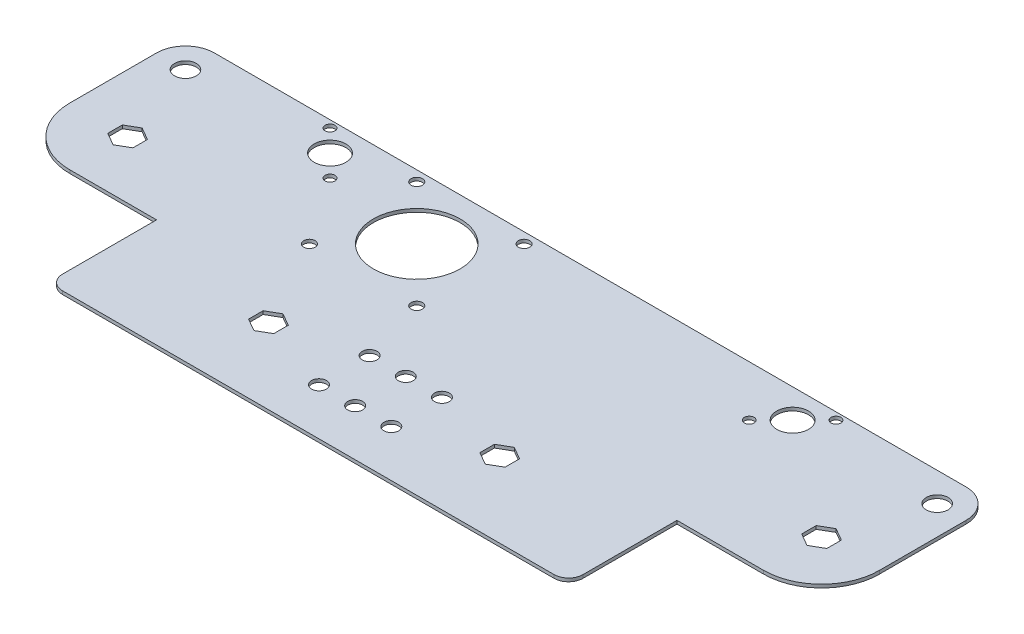
from build123d import *

# Parameters (mm, degrees)
SKETCH1_R           = 3.2639
SKETCH1_R_2         = 2.5019
SKETCH1_R_3         = 6.985
SKETCH1_R_4         = 2.159
SKETCH1_R_5         = 19.05
SKETCH1_R_6         = 4.7625
BOSS_EXTRUDE1_DEPTH = 1.4478


with BuildPart() as part:
    # Sketch1 → Boss-Extrude1 (new body)
    with BuildSketch(Plane(origin=(0, 0, 0), x_dir=(1, 0, 0), z_dir=(0, 1, 0))):
        with BuildLine():
            Line((-70.748540962, -286.823205678), (-108.848540962, -286.823205678))
            ThreePointArc((-108.848540962, -286.823205678), (-126.809053204, -279.38371792), (-134.248540962, -261.423205678))
            Line((-134.248540962, -261.423205678), (-134.248540962, -223.323205678))
            ThreePointArc((-134.248540962, -223.323205678), (-130.528797083, -214.342949557), (-121.548540962, -210.623205678))
            Line((-121.548540962, -210.623205678), (208.651459038, -210.623205678))
            ThreePointArc((208.651459038, -210.623205678), (217.631715159, -214.342949557), (221.351459038, -223.323205678))
            Line((221.351459038, -223.323205678), (221.351459038, -261.423205678))
            ThreePointArc((221.351459038, -261.423205678), (213.911971281, -279.38371792), (195.951459038, -286.823205678))
            Line((195.951459038, -286.823205678), (157.851459038, -286.823205678))
            Line((157.851459038, -286.823205678), (157.851459038, -328.098205678))
            ThreePointArc((157.851459038, -328.098205678), (155.991587099, -332.588333738), (151.501459038, -334.448205678))
            Line((151.501459038, -334.448205678), (-64.398540962, -334.448205678))
            ThreePointArc((-64.398540962, -334.448205678), (-68.888669022, -332.588333738), (-70.748540962, -328.098205678))
            Line((-70.748540962, -328.098205678), (-70.748540962, -286.823205678))
        make_face()
        with Locations(Location((27.676459038, -291.649205678, 0), (0, 0, 270))):
            Circle(SKETCH1_R, mode=Mode.SUBTRACT)
        with Locations(Location((43.551459038, -291.649205678, 0), (0, 0, 270))):
            Circle(SKETCH1_R, mode=Mode.SUBTRACT)
        with Locations(Location((59.426459038, -291.649205678, 0), (0, 0, 270))):
            Circle(SKETCH1_R, mode=Mode.SUBTRACT)
        with Locations(Location((-28.025740962, -215.246005678, 0), (0, 0, 270))):
            Circle(SKETCH1_R_2, mode=Mode.SUBTRACT)
        with Locations(Location((-28.025740962, -262.388405678, 0), (0, 0, 90))):
            Circle(SKETCH1_R_2, mode=Mode.SUBTRACT)
        with Locations(Location((19.116659038, -215.246005678, 0), (0, 0, 90))):
            Circle(SKETCH1_R_2, mode=Mode.SUBTRACT)
        with Locations(Location((19.116659038, -262.388405678, 0), (0, 0, 270))):
            Circle(SKETCH1_R_2, mode=Mode.SUBTRACT)
        with Locations(Location((27.676459038, -313.874205678, 0), (0, 0, 270))):
            Circle(SKETCH1_R, mode=Mode.SUBTRACT)
        with Locations(Location((43.551459038, -313.874205678, 0), (0, 0, 270))):
            Circle(SKETCH1_R, mode=Mode.SUBTRACT)
        with Locations(Location((59.426459038, -313.874205678, 0), (0, 0, 270))):
            Circle(SKETCH1_R, mode=Mode.SUBTRACT)
        with Locations(Location((-58.048540962, -223.323205678, 0), (0, 0, 270))):
            Circle(SKETCH1_R_3, mode=Mode.SUBTRACT)
        with Locations(Location((-67.573540962, -213.798205678, 0), (0, 0, 270))):
            Circle(SKETCH1_R_4, mode=Mode.SUBTRACT)
        with Locations(Location((-48.523540962, -232.848205678, 0), (0, 0, 270))):
            Circle(SKETCH1_R_4, mode=Mode.SUBTRACT)
        with Locations(Location((-4.454540962, -238.817205678, 0), (0, 0, 270))):
            Circle(SKETCH1_R_5, mode=Mode.SUBTRACT)
        with Locations(Location((135.626459038, -232.848205678, 0), (0, 0, 90))):
            Circle(SKETCH1_R_4, mode=Mode.SUBTRACT)
        with Locations(Location((145.151459038, -223.323205678, 0), (0, 0, 90))):
            Circle(SKETCH1_R_3, mode=Mode.SUBTRACT)
        with Locations(Location((154.676459038, -213.798205678, 0), (0, 0, 90))):
            Circle(SKETCH1_R_4, mode=Mode.SUBTRACT)
        with Locations(Location((-121.548540962, -223.323205678, 0), (0, 0, 270))):
            Circle(SKETCH1_R_6, mode=Mode.SUBTRACT)
        with Locations(Location((208.651459038, -223.323205678, 0), (0, 0, 270))):
            Circle(SKETCH1_R_6, mode=Mode.SUBTRACT)
        Polygon((-1.724040962, -304.36377724), (-1.724040962, -297.984634115), (-7.248540962, -294.795062553), (-12.773040962, -297.984634115), (-12.773040962, -304.36377724), (-7.248540962, -307.553348802), align=None, mode=Mode.SUBTRACT)
        Polygon((94.351459038, -307.553348802), (88.826959038, -304.36377724), (88.826959038, -297.984634115), (94.351459038, -294.795062553), (99.875959038, -297.984634115), (99.875959038, -304.36377724), align=None, mode=Mode.SUBTRACT)
        Polygon((-103.324040962, -258.233634115), (-108.848540962, -255.044062553), (-114.373040962, -258.233634115), (-114.373040962, -264.61277724), (-108.848540962, -267.802348802), (-103.324040962, -264.61277724), align=None, mode=Mode.SUBTRACT)
        Polygon((201.475959038, -264.61277724), (195.951459038, -267.802348802), (190.426959038, -264.61277724), (190.426959038, -258.233634115), (195.951459038, -255.044062553), (201.475959038, -258.233634115), align=None, mode=Mode.SUBTRACT)
    extrude(amount=BOSS_EXTRUDE1_DEPTH)


solid = part.part
